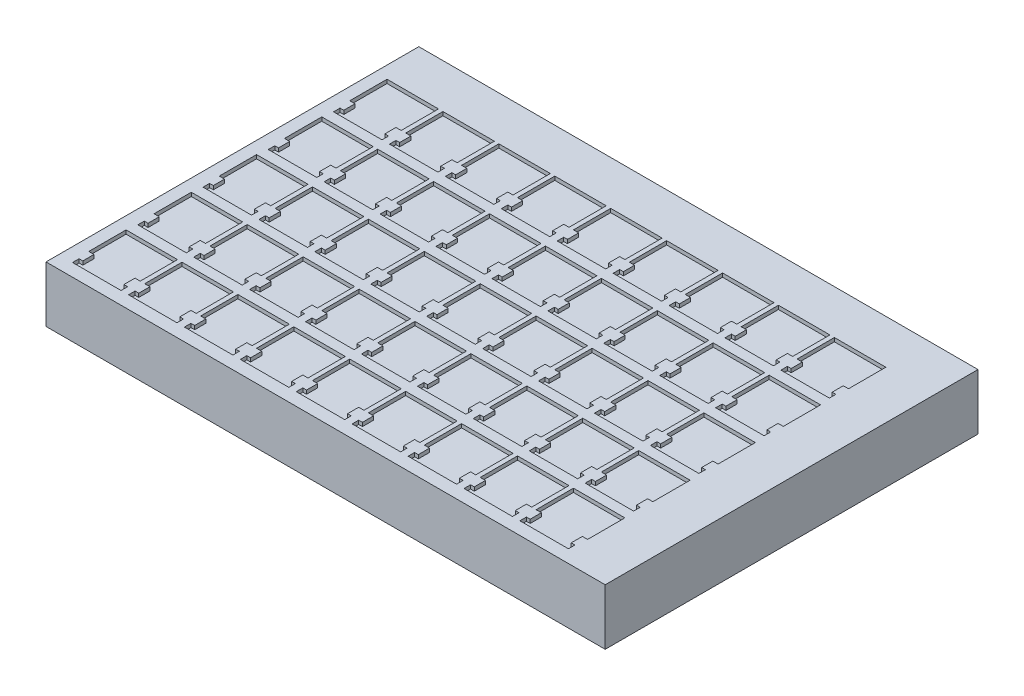
from build123d import *

# Parameters (mm, degrees)
SKETCH1_W           = 300
SKETCH1_H           = 200
BOSS_EXTRUDE1_DEPTH = 30
CUT_EXTRUDE1_DEPTH  = 2


with BuildPart() as part:
    # Sketch1 → Boss-Extrude1 (new body)
    with BuildSketch(Plane(origin=(0, 0, 0), x_dir=(1, 0, 0), z_dir=(0, 1, 0))):
        with Locations((150, 100)):
            Rectangle(SKETCH1_W, SKETCH1_H)
    extrude(amount=BOSS_EXTRUDE1_DEPTH)

    # Sketch2 → Cut-Extrude1 (cut)
    with BuildSketch(Plane(origin=(0, 30, 0), x_dir=(1, 0, 0), z_dir=(0, 1, 0))):
        Polygon((33.404699756, 6.851162517), (7.404699756, 6.851162517), (7.404699756, 10.351162517), (9.404699756, 10.351162517), (9.404699756, 16.351162517), (6.604699756, 16.351162517), (6.604699756, 36.351162517), (34.204699756, 36.351162517), (34.204699756, 16.351162517), (31.404699756, 16.351162517), (31.404699756, 10.351162517), (33.404699756, 10.351162517), align=None)
        Polygon((63.404699756, 6.851162517), (37.404699756, 6.851162517), (37.404699756, 10.351162517), (39.404699756, 10.351162517), (39.404699756, 16.351162517), (36.604699756, 16.351162517), (36.604699756, 36.351162517), (64.204699756, 36.351162517), (64.204699756, 16.351162517), (61.404699756, 16.351162517), (61.404699756, 10.351162517), (63.404699756, 10.351162517), align=None)
        Polygon((93.404699756, 6.851162517), (67.404699756, 6.851162517), (67.404699756, 10.351162517), (69.404699756, 10.351162517), (69.404699756, 16.351162517), (66.604699756, 16.351162517), (66.604699756, 36.351162517), (94.204699756, 36.351162517), (94.204699756, 16.351162517), (91.404699756, 16.351162517), (91.404699756, 10.351162517), (93.404699756, 10.351162517), align=None)
        Polygon((123.404699756, 6.851162517), (97.404699756, 6.851162517), (97.404699756, 10.351162517), (99.404699756, 10.351162517), (99.404699756, 16.351162517), (96.604699756, 16.351162517), (96.604699756, 36.351162517), (124.204699756, 36.351162517), (124.204699756, 16.351162517), (121.404699756, 16.351162517), (121.404699756, 10.351162517), (123.404699756, 10.351162517), align=None)
        Polygon((153.404699756, 6.851162517), (127.404699756, 6.851162517), (127.404699756, 10.351162517), (129.404699756, 10.351162517), (129.404699756, 16.351162517), (126.604699756, 16.351162517), (126.604699756, 36.351162517), (154.204699756, 36.351162517), (154.204699756, 16.351162517), (151.404699756, 16.351162517), (151.404699756, 10.351162517), (153.404699756, 10.351162517), align=None)
        Polygon((183.404699756, 6.851162517), (157.404699756, 6.851162517), (157.404699756, 10.351162517), (159.404699756, 10.351162517), (159.404699756, 16.351162517), (156.604699756, 16.351162517), (156.604699756, 36.351162517), (184.204699756, 36.351162517), (184.204699756, 16.351162517), (181.404699756, 16.351162517), (181.404699756, 10.351162517), (183.404699756, 10.351162517), align=None)
        Polygon((213.404699756, 6.851162517), (187.404699756, 6.851162517), (187.404699756, 10.351162517), (189.404699756, 10.351162517), (189.404699756, 16.351162517), (186.604699756, 16.351162517), (186.604699756, 36.351162517), (214.204699756, 36.351162517), (214.204699756, 16.351162517), (211.404699756, 16.351162517), (211.404699756, 10.351162517), (213.404699756, 10.351162517), align=None)
        Polygon((243.404699756, 6.851162517), (217.404699756, 6.851162517), (217.404699756, 10.351162517), (219.404699756, 10.351162517), (219.404699756, 16.351162517), (216.604699756, 16.351162517), (216.604699756, 36.351162517), (244.204699756, 36.351162517), (244.204699756, 16.351162517), (241.404699756, 16.351162517), (241.404699756, 10.351162517), (243.404699756, 10.351162517), align=None)
        Polygon((273.404699756, 6.851162517), (247.404699756, 6.851162517), (247.404699756, 10.351162517), (249.404699756, 10.351162517), (249.404699756, 16.351162517), (246.604699756, 16.351162517), (246.604699756, 36.351162517), (274.204699756, 36.351162517), (274.204699756, 16.351162517), (271.404699756, 16.351162517), (271.404699756, 10.351162517), (273.404699756, 10.351162517), align=None)
        Polygon((63.404699756, 41.851162517), (37.404699756, 41.851162517), (37.404699756, 45.351162517), (39.404699756, 45.351162517), (39.404699756, 51.351162517), (36.604699756, 51.351162517), (36.604699756, 71.351162517), (64.204699756, 71.351162517), (64.204699756, 51.351162517), (61.404699756, 51.351162517), (61.404699756, 45.351162517), (63.404699756, 45.351162517), align=None)
        Polygon((93.404699756, 41.851162517), (67.404699756, 41.851162517), (67.404699756, 45.351162517), (69.404699756, 45.351162517), (69.404699756, 51.351162517), (66.604699756, 51.351162517), (66.604699756, 71.351162517), (94.204699756, 71.351162517), (94.204699756, 51.351162517), (91.404699756, 51.351162517), (91.404699756, 45.351162517), (93.404699756, 45.351162517), align=None)
        Polygon((123.404699756, 41.851162517), (97.404699756, 41.851162517), (97.404699756, 45.351162517), (99.404699756, 45.351162517), (99.404699756, 51.351162517), (96.604699756, 51.351162517), (96.604699756, 71.351162517), (124.204699756, 71.351162517), (124.204699756, 51.351162517), (121.404699756, 51.351162517), (121.404699756, 45.351162517), (123.404699756, 45.351162517), align=None)
        Polygon((153.404699756, 41.851162517), (127.404699756, 41.851162517), (127.404699756, 45.351162517), (129.404699756, 45.351162517), (129.404699756, 51.351162517), (126.604699756, 51.351162517), (126.604699756, 71.351162517), (154.204699756, 71.351162517), (154.204699756, 51.351162517), (151.404699756, 51.351162517), (151.404699756, 45.351162517), (153.404699756, 45.351162517), align=None)
        Polygon((183.404699756, 41.851162517), (157.404699756, 41.851162517), (157.404699756, 45.351162517), (159.404699756, 45.351162517), (159.404699756, 51.351162517), (156.604699756, 51.351162517), (156.604699756, 71.351162517), (184.204699756, 71.351162517), (184.204699756, 51.351162517), (181.404699756, 51.351162517), (181.404699756, 45.351162517), (183.404699756, 45.351162517), align=None)
        Polygon((213.404699756, 41.851162517), (187.404699756, 41.851162517), (187.404699756, 45.351162517), (189.404699756, 45.351162517), (189.404699756, 51.351162517), (186.604699756, 51.351162517), (186.604699756, 71.351162517), (214.204699756, 71.351162517), (214.204699756, 51.351162517), (211.404699756, 51.351162517), (211.404699756, 45.351162517), (213.404699756, 45.351162517), align=None)
        Polygon((243.404699756, 41.851162517), (217.404699756, 41.851162517), (217.404699756, 45.351162517), (219.404699756, 45.351162517), (219.404699756, 51.351162517), (216.604699756, 51.351162517), (216.604699756, 71.351162517), (244.204699756, 71.351162517), (244.204699756, 51.351162517), (241.404699756, 51.351162517), (241.404699756, 45.351162517), (243.404699756, 45.351162517), align=None)
        Polygon((273.404699756, 41.851162517), (247.404699756, 41.851162517), (247.404699756, 45.351162517), (249.404699756, 45.351162517), (249.404699756, 51.351162517), (246.604699756, 51.351162517), (246.604699756, 71.351162517), (274.204699756, 71.351162517), (274.204699756, 51.351162517), (271.404699756, 51.351162517), (271.404699756, 45.351162517), (273.404699756, 45.351162517), align=None)
        Polygon((63.404699756, 76.851162517), (37.404699756, 76.851162517), (37.404699756, 80.351162517), (39.404699756, 80.351162517), (39.404699756, 86.351162517), (36.604699756, 86.351162517), (36.604699756, 106.351162517), (64.204699756, 106.351162517), (64.204699756, 86.351162517), (61.404699756, 86.351162517), (61.404699756, 80.351162517), (63.404699756, 80.351162517), align=None)
        Polygon((93.404699756, 76.851162517), (67.404699756, 76.851162517), (67.404699756, 80.351162517), (69.404699756, 80.351162517), (69.404699756, 86.351162517), (66.604699756, 86.351162517), (66.604699756, 106.351162517), (94.204699756, 106.351162517), (94.204699756, 86.351162517), (91.404699756, 86.351162517), (91.404699756, 80.351162517), (93.404699756, 80.351162517), align=None)
        Polygon((123.404699756, 76.851162517), (97.404699756, 76.851162517), (97.404699756, 80.351162517), (99.404699756, 80.351162517), (99.404699756, 86.351162517), (96.604699756, 86.351162517), (96.604699756, 106.351162517), (124.204699756, 106.351162517), (124.204699756, 86.351162517), (121.404699756, 86.351162517), (121.404699756, 80.351162517), (123.404699756, 80.351162517), align=None)
        Polygon((153.404699756, 76.851162517), (127.404699756, 76.851162517), (127.404699756, 80.351162517), (129.404699756, 80.351162517), (129.404699756, 86.351162517), (126.604699756, 86.351162517), (126.604699756, 106.351162517), (154.204699756, 106.351162517), (154.204699756, 86.351162517), (151.404699756, 86.351162517), (151.404699756, 80.351162517), (153.404699756, 80.351162517), align=None)
        Polygon((183.404699756, 76.851162517), (157.404699756, 76.851162517), (157.404699756, 80.351162517), (159.404699756, 80.351162517), (159.404699756, 86.351162517), (156.604699756, 86.351162517), (156.604699756, 106.351162517), (184.204699756, 106.351162517), (184.204699756, 86.351162517), (181.404699756, 86.351162517), (181.404699756, 80.351162517), (183.404699756, 80.351162517), align=None)
        Polygon((213.404699756, 76.851162517), (187.404699756, 76.851162517), (187.404699756, 80.351162517), (189.404699756, 80.351162517), (189.404699756, 86.351162517), (186.604699756, 86.351162517), (186.604699756, 106.351162517), (214.204699756, 106.351162517), (214.204699756, 86.351162517), (211.404699756, 86.351162517), (211.404699756, 80.351162517), (213.404699756, 80.351162517), align=None)
        Polygon((243.404699756, 76.851162517), (217.404699756, 76.851162517), (217.404699756, 80.351162517), (219.404699756, 80.351162517), (219.404699756, 86.351162517), (216.604699756, 86.351162517), (216.604699756, 106.351162517), (244.204699756, 106.351162517), (244.204699756, 86.351162517), (241.404699756, 86.351162517), (241.404699756, 80.351162517), (243.404699756, 80.351162517), align=None)
        Polygon((273.404699756, 76.851162517), (247.404699756, 76.851162517), (247.404699756, 80.351162517), (249.404699756, 80.351162517), (249.404699756, 86.351162517), (246.604699756, 86.351162517), (246.604699756, 106.351162517), (274.204699756, 106.351162517), (274.204699756, 86.351162517), (271.404699756, 86.351162517), (271.404699756, 80.351162517), (273.404699756, 80.351162517), align=None)
        Polygon((63.404699756, 111.851162517), (37.404699756, 111.851162517), (37.404699756, 115.351162517), (39.404699756, 115.351162517), (39.404699756, 121.351162517), (36.604699756, 121.351162517), (36.604699756, 141.351162517), (64.204699756, 141.351162517), (64.204699756, 121.351162517), (61.404699756, 121.351162517), (61.404699756, 115.351162517), (63.404699756, 115.351162517), align=None)
        Polygon((93.404699756, 111.851162517), (67.404699756, 111.851162517), (67.404699756, 115.351162517), (69.404699756, 115.351162517), (69.404699756, 121.351162517), (66.604699756, 121.351162517), (66.604699756, 141.351162517), (94.204699756, 141.351162517), (94.204699756, 121.351162517), (91.404699756, 121.351162517), (91.404699756, 115.351162517), (93.404699756, 115.351162517), align=None)
        Polygon((123.404699756, 111.851162517), (97.404699756, 111.851162517), (97.404699756, 115.351162517), (99.404699756, 115.351162517), (99.404699756, 121.351162517), (96.604699756, 121.351162517), (96.604699756, 141.351162517), (124.204699756, 141.351162517), (124.204699756, 121.351162517), (121.404699756, 121.351162517), (121.404699756, 115.351162517), (123.404699756, 115.351162517), align=None)
        Polygon((153.404699756, 111.851162517), (127.404699756, 111.851162517), (127.404699756, 115.351162517), (129.404699756, 115.351162517), (129.404699756, 121.351162517), (126.604699756, 121.351162517), (126.604699756, 141.351162517), (154.204699756, 141.351162517), (154.204699756, 121.351162517), (151.404699756, 121.351162517), (151.404699756, 115.351162517), (153.404699756, 115.351162517), align=None)
        Polygon((183.404699756, 111.851162517), (157.404699756, 111.851162517), (157.404699756, 115.351162517), (159.404699756, 115.351162517), (159.404699756, 121.351162517), (156.604699756, 121.351162517), (156.604699756, 141.351162517), (184.204699756, 141.351162517), (184.204699756, 121.351162517), (181.404699756, 121.351162517), (181.404699756, 115.351162517), (183.404699756, 115.351162517), align=None)
        Polygon((213.404699756, 111.851162517), (187.404699756, 111.851162517), (187.404699756, 115.351162517), (189.404699756, 115.351162517), (189.404699756, 121.351162517), (186.604699756, 121.351162517), (186.604699756, 141.351162517), (214.204699756, 141.351162517), (214.204699756, 121.351162517), (211.404699756, 121.351162517), (211.404699756, 115.351162517), (213.404699756, 115.351162517), align=None)
        Polygon((243.404699756, 111.851162517), (217.404699756, 111.851162517), (217.404699756, 115.351162517), (219.404699756, 115.351162517), (219.404699756, 121.351162517), (216.604699756, 121.351162517), (216.604699756, 141.351162517), (244.204699756, 141.351162517), (244.204699756, 121.351162517), (241.404699756, 121.351162517), (241.404699756, 115.351162517), (243.404699756, 115.351162517), align=None)
        Polygon((273.404699756, 111.851162517), (247.404699756, 111.851162517), (247.404699756, 115.351162517), (249.404699756, 115.351162517), (249.404699756, 121.351162517), (246.604699756, 121.351162517), (246.604699756, 141.351162517), (274.204699756, 141.351162517), (274.204699756, 121.351162517), (271.404699756, 121.351162517), (271.404699756, 115.351162517), (273.404699756, 115.351162517), align=None)
        Polygon((63.404699756, 146.851162517), (37.404699756, 146.851162517), (37.404699756, 150.351162517), (39.404699756, 150.351162517), (39.404699756, 156.351162517), (36.604699756, 156.351162517), (36.604699756, 176.351162517), (64.204699756, 176.351162517), (64.204699756, 156.351162517), (61.404699756, 156.351162517), (61.404699756, 150.351162517), (63.404699756, 150.351162517), align=None)
        Polygon((93.404699756, 146.851162517), (67.404699756, 146.851162517), (67.404699756, 150.351162517), (69.404699756, 150.351162517), (69.404699756, 156.351162517), (66.604699756, 156.351162517), (66.604699756, 176.351162517), (94.204699756, 176.351162517), (94.204699756, 156.351162517), (91.404699756, 156.351162517), (91.404699756, 150.351162517), (93.404699756, 150.351162517), align=None)
        Polygon((123.404699756, 146.851162517), (97.404699756, 146.851162517), (97.404699756, 150.351162517), (99.404699756, 150.351162517), (99.404699756, 156.351162517), (96.604699756, 156.351162517), (96.604699756, 176.351162517), (124.204699756, 176.351162517), (124.204699756, 156.351162517), (121.404699756, 156.351162517), (121.404699756, 150.351162517), (123.404699756, 150.351162517), align=None)
        Polygon((153.404699756, 146.851162517), (127.404699756, 146.851162517), (127.404699756, 150.351162517), (129.404699756, 150.351162517), (129.404699756, 156.351162517), (126.604699756, 156.351162517), (126.604699756, 176.351162517), (154.204699756, 176.351162517), (154.204699756, 156.351162517), (151.404699756, 156.351162517), (151.404699756, 150.351162517), (153.404699756, 150.351162517), align=None)
        Polygon((183.404699756, 146.851162517), (157.404699756, 146.851162517), (157.404699756, 150.351162517), (159.404699756, 150.351162517), (159.404699756, 156.351162517), (156.604699756, 156.351162517), (156.604699756, 176.351162517), (184.204699756, 176.351162517), (184.204699756, 156.351162517), (181.404699756, 156.351162517), (181.404699756, 150.351162517), (183.404699756, 150.351162517), align=None)
        Polygon((213.404699756, 146.851162517), (187.404699756, 146.851162517), (187.404699756, 150.351162517), (189.404699756, 150.351162517), (189.404699756, 156.351162517), (186.604699756, 156.351162517), (186.604699756, 176.351162517), (214.204699756, 176.351162517), (214.204699756, 156.351162517), (211.404699756, 156.351162517), (211.404699756, 150.351162517), (213.404699756, 150.351162517), align=None)
        Polygon((243.404699756, 146.851162517), (217.404699756, 146.851162517), (217.404699756, 150.351162517), (219.404699756, 150.351162517), (219.404699756, 156.351162517), (216.604699756, 156.351162517), (216.604699756, 176.351162517), (244.204699756, 176.351162517), (244.204699756, 156.351162517), (241.404699756, 156.351162517), (241.404699756, 150.351162517), (243.404699756, 150.351162517), align=None)
        Polygon((273.404699756, 146.851162517), (247.404699756, 146.851162517), (247.404699756, 150.351162517), (249.404699756, 150.351162517), (249.404699756, 156.351162517), (246.604699756, 156.351162517), (246.604699756, 176.351162517), (274.204699756, 176.351162517), (274.204699756, 156.351162517), (271.404699756, 156.351162517), (271.404699756, 150.351162517), (273.404699756, 150.351162517), align=None)
        Polygon((33.404699756, 41.851162517), (7.404699756, 41.851162517), (7.404699756, 45.351162517), (9.404699756, 45.351162517), (9.404699756, 51.351162517), (6.604699756, 51.351162517), (6.604699756, 71.351162517), (34.204699756, 71.351162517), (34.204699756, 51.351162517), (31.404699756, 51.351162517), (31.404699756, 45.351162517), (33.404699756, 45.351162517), align=None)
        Polygon((33.404699756, 76.851162517), (7.404699756, 76.851162517), (7.404699756, 80.351162517), (9.404699756, 80.351162517), (9.404699756, 86.351162517), (6.604699756, 86.351162517), (6.604699756, 106.351162517), (34.204699756, 106.351162517), (34.204699756, 86.351162517), (31.404699756, 86.351162517), (31.404699756, 80.351162517), (33.404699756, 80.351162517), align=None)
        Polygon((33.404699756, 111.851162517), (7.404699756, 111.851162517), (7.404699756, 115.351162517), (9.404699756, 115.351162517), (9.404699756, 121.351162517), (6.604699756, 121.351162517), (6.604699756, 141.351162517), (34.204699756, 141.351162517), (34.204699756, 121.351162517), (31.404699756, 121.351162517), (31.404699756, 115.351162517), (33.404699756, 115.351162517), align=None)
        Polygon((33.404699756, 146.851162517), (7.404699756, 146.851162517), (7.404699756, 150.351162517), (9.404699756, 150.351162517), (9.404699756, 156.351162517), (6.604699756, 156.351162517), (6.604699756, 176.351162517), (34.204699756, 176.351162517), (34.204699756, 156.351162517), (31.404699756, 156.351162517), (31.404699756, 150.351162517), (33.404699756, 150.351162517), align=None)
    extrude(amount=-CUT_EXTRUDE1_DEPTH, mode=Mode.SUBTRACT)


solid = part.part
